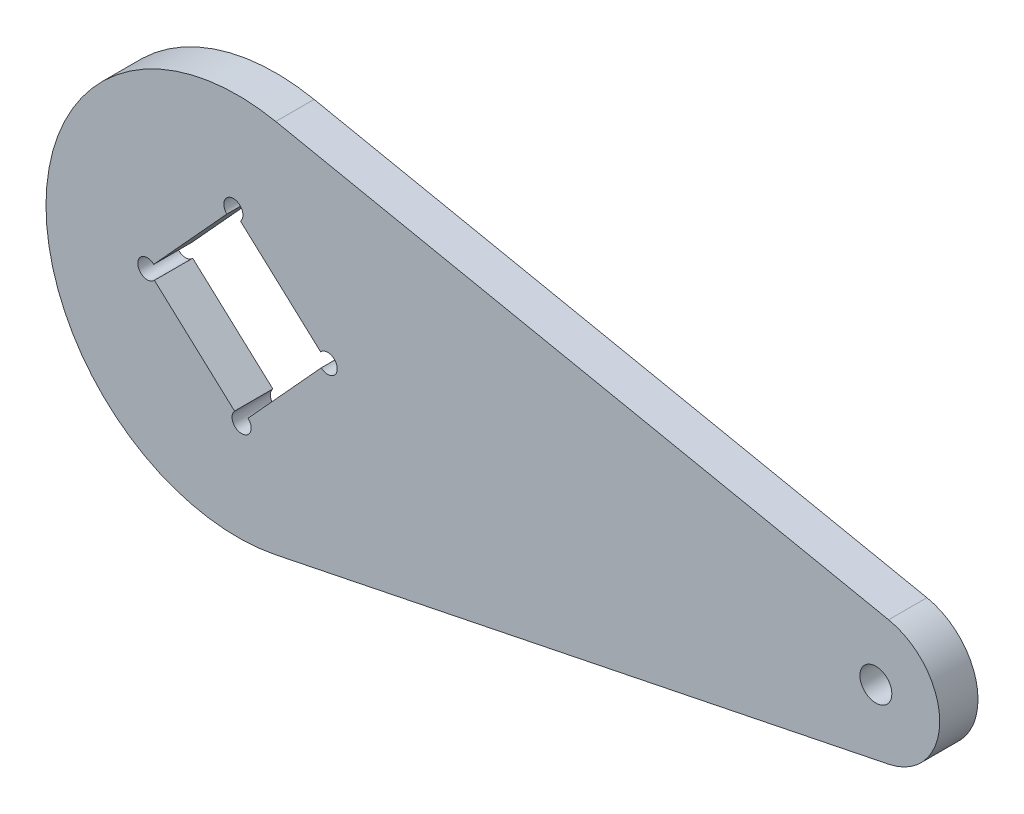
from build123d import *

# Parameters (mm, degrees)
SKETCH_1_R      = 2.5
EXTRUDE_1_DEPTH = 6


with BuildPart() as part:
    # 草图1 → 凸台-拉伸1 (new body)
    with BuildSketch(Plane.XY):
        with BuildLine():
            ThreePointArc((6, 29.393876913), (-30, 0), (6, -29.393876913))
            Line((6, -29.393876913), (102, -9.797958971))
            ThreePointArc((102, -9.797958971), (110, 0), (102, 9.797958971))
            Line((102, 9.797958971), (6, 29.393876913))
        make_face()
        with BuildLine():
            ThreePointArc((-13.019316478, -1.657527811), (-15.625784497, -0.715028484), (-13.11628562, 0.461575061))
            Line((-13.11628562, 0.461575061), (-1.657527811, 13.019316478))
            ThreePointArc((-1.657527811, 13.019316478), (-1.252018417, 15.499686318), (0.853539054, 14.127352485))
            ThreePointArc((0.853539054, 14.127352485), (0.752119408, 13.58515972), (0.461575061, 13.11628562))
            Line((0.461575061, 13.11628562), (13.019316478, 1.657527811))
            ThreePointArc((13.019316478, 1.657527811), (14.66954525, 2.0450413), (15.627352485, 0.646460946))
            ThreePointArc((15.627352485, 0.646460946), (14.732909957, -0.725872887), (13.11628562, -0.461575061))
            Line((13.11628562, -0.461575061), (1.657527811, -13.019316478))
            ThreePointArc((1.657527811, -13.019316478), (2.018794779, -13.521795014), (2.146460946, -14.127352485))
            ThreePointArc((2.146460946, -14.127352485), (0.104268181, -15.525932839), (-0.461575061, -13.11628562))
            Line((-0.461575061, -13.11628562), (-13.019316478, -1.657527811))
        make_face(mode=Mode.SUBTRACT)
        with Locations((100, 0)):
            Circle(SKETCH_1_R, mode=Mode.SUBTRACT)
    extrude(amount=EXTRUDE_1_DEPTH)


solid = part.part
